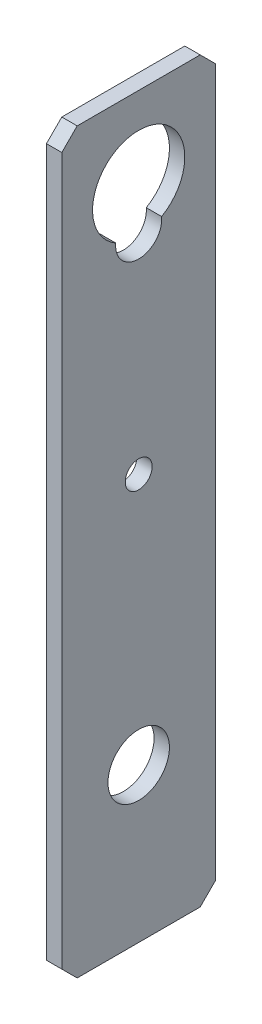
from build123d import *

# Parameters (mm, degrees)
SKETCH1_W           = 20
SKETCH1_H           = 96
BOSS_EXTRUDE1_DEPTH = 2
SKETCH2_R           = 1.75
SKETCH2_R_2         = 4
CUT_EXTRUDE1_DEPTH  = 99.081598682
CHAMFER1_SIZE       = 2


with BuildPart() as part:
    # Sketch1 → Boss-Extrude1 (new body)
    with BuildSketch(Plane(origin=(0, 0, 0), x_dir=(0, 0, -1), z_dir=(1, 0, 0))):
        with Locations((10, 48)):
            Rectangle(SKETCH1_W, SKETCH1_H)
    extrude(amount=BOSS_EXTRUDE1_DEPTH)

    # Sketch2 → Cut-Extrude1 (cut, through all)
    with BuildSketch(Plane(origin=(2, 0, 0), x_dir=(0, 0, -1), z_dir=(1, 0, 0))):
        with Locations((10, 52.75)):
            Circle(SKETCH2_R)
        with Locations((10, 20)):
            Circle(SKETCH2_R_2)
        with BuildLine():
            ThreePointArc((12.985415651, 80.295454545), (10, 91.5), (7.014584349, 80.295454545))
            ThreePointArc((7.014584349, 80.295454545), (10, 77), (12.985415651, 80.295454545))
        make_face()
    extrude(amount=-CUT_EXTRUDE1_DEPTH, mode=Mode.SUBTRACT)

    # Chamfer1
    chamfer1_edges = [part.edges().sort_by_distance(p)[0] for p in [
        (1, 96, 0),
        (1, 96, -20),
        (1, 0, -20),
        (1, 0, 0),
    ]]
    chamfer(chamfer1_edges, length=CHAMFER1_SIZE)


solid = part.part
